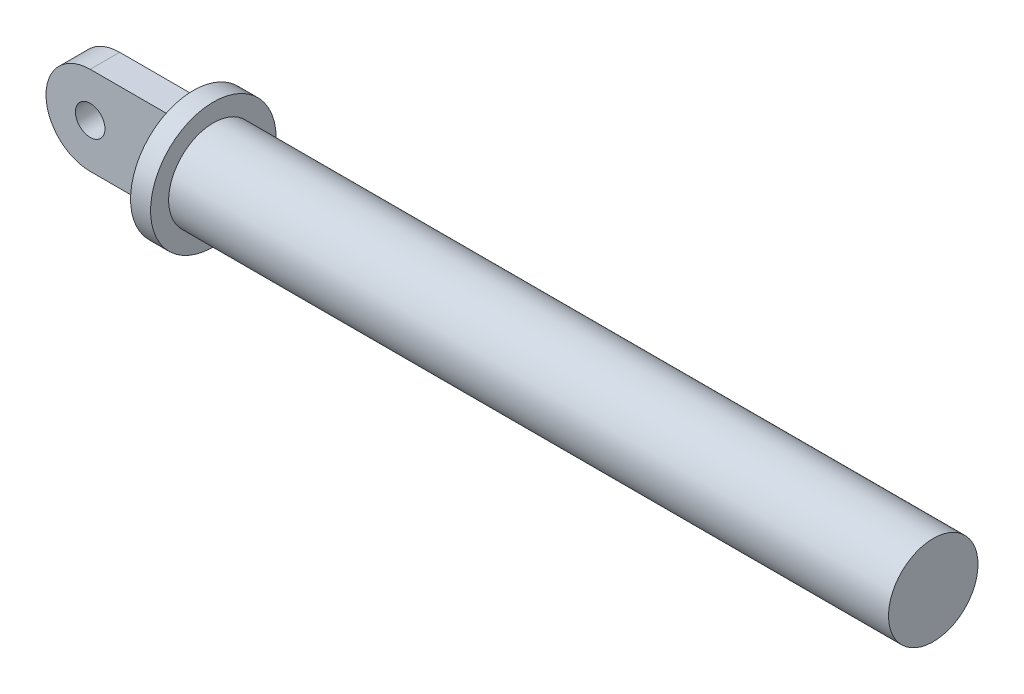
from build123d import *

# Parameters (mm, degrees)
SKETCH1_R           = 5.00368331
BOSS_EXTRUDE1_DEPTH = 5


with BuildPart() as part:
    # Sketch1 → Boss-Extrude1 (new, symmetric)
    with BuildSketch(Plane.XY):
        with BuildLine():
            Line((-52.418935372, 39.017679889), (-22.418935372, 39.017679889))
            Line((-22.418935372, 39.017679889), (-22.418935372, 9.017679889))
            Line((-22.418935372, 9.017679889), (-52.418935372, 9.017679889))
            ThreePointArc((-52.418935372, 9.017679889), (-67.418935372, 24.017679889), (-52.418935372, 39.017679889))
        make_face()
        with Locations((-52.418935372, 24.017679889)):
            Circle(SKETCH1_R, mode=Mode.SUBTRACT)
    extrude(amount=BOSS_EXTRUDE1_DEPTH, both=True)

    # Sketch2 → Revolve4 (revolve)
    with BuildSketch(Plane.XY, mode=Mode.PRIVATE) as revolve4_sk:
        Polygon((-22.418935372, 24.017679889), (-22.418935372, 45.324269268), (-15.62342474, 45.324269268), (-15.62342474, 39.194903503), (228.633930204, 39.194903503), (228.633930204, 24.017679889), align=None)
    revolve(revolve4_sk.sketch.rotate(Axis((228.633930204, 24.017679889, 0), (-1, 0, 0)), 90), axis=Axis((228.633930204, 24.017679889, 0), (-1, 0, 0)))


solid = part.part
